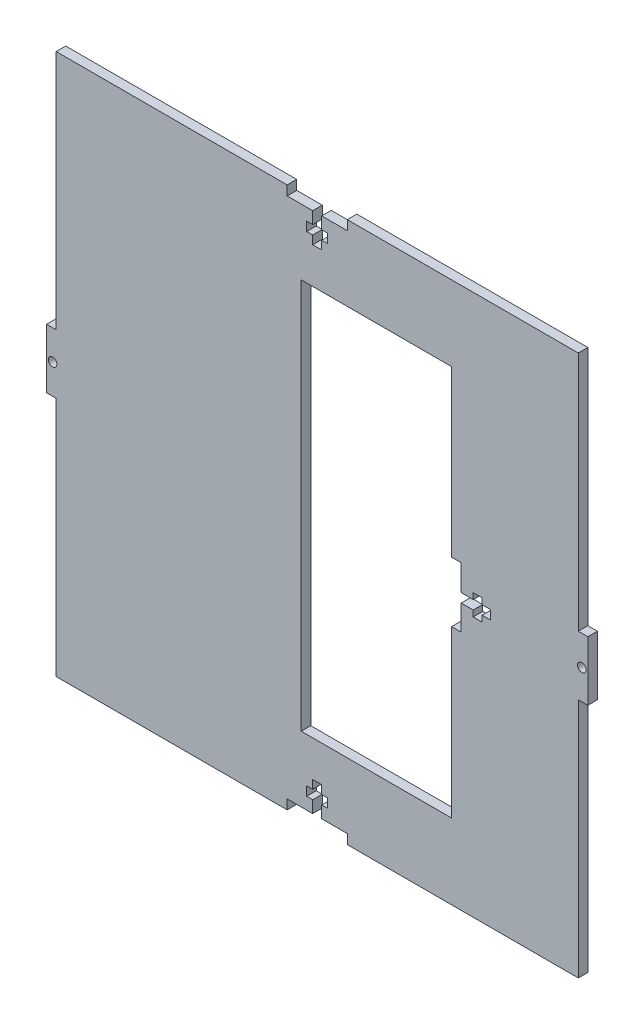
from build123d import *

# Parameters (mm, degrees)
SKETCH3_W           = 180
SKETCH3_H           = 180
BOSS_EXTRUDE1_DEPTH = 3.18
CUT_EXTRUDE1_DEPTH  = 128.318939675
SKETCH5_R           = 1.436023081
SKETCH5_W           = 3.18
SKETCH5_H           = 80.125
CUT_EXTRUDE2_DEPTH  = 128.318939675


with BuildPart() as part:
    # Sketch3 → Boss-Extrude1 (new body)
    with BuildSketch(Plane.XY):
        Rectangle(SKETCH3_W, SKETCH3_H)
        Polygon((44.679729843, -65), (-5.320270157, -65), (-5.320270157, 65), (44.679729843, 65), (44.679729843, 10.125), (47.859729843, 10.125), (47.859729843, 1.5), (51.859729843, 1.5), (51.859729843, 3.5), (54.859729843, 3.5), (54.859729843, 1.5), (57.679729843, 1.5), (57.679729843, -1.5), (54.859729843, -1.5), (54.859729843, -3.5), (51.859729843, -3.5), (51.859729843, -1.5), (47.859729843, -1.5), (47.859729843, -9.875), (44.679729843, -9.875), align=None, mode=Mode.SUBTRACT)
    extrude(amount=BOSS_EXTRUDE1_DEPTH)

    # Sketch4 → Cut-Extrude1 (cut, through all)
    with BuildSketch(Plane.XY.offset(3.18)):
        Polygon((1.5, 86.82), (10, 86.82), (10, 90), (-10, 90), (-10, 86.82), (-1.5, 86.82), (-1.5, 82.82), (-3.5, 82.82), (-3.5, 79.82), (-1.5, 79.82), (-1.5, 77), (1.5, 77), (1.5, 79.82), (3.5, 79.82), (3.5, 82.82), (1.5, 82.82), align=None)
        Polygon((1.5, -79.82), (1.5, -77), (-1.5, -77), (-1.5, -79.82), (-3.5, -79.82), (-3.5, -82.82), (-1.5, -82.82), (-1.5, -86.82), (-10, -86.82), (-10, -90), (10, -90), (10, -86.82), (1.5, -86.82), (1.5, -82.82), (3.5, -82.82), (3.5, -79.82), align=None)
    extrude(amount=-CUT_EXTRUDE1_DEPTH, mode=Mode.SUBTRACT)

    # Sketch5 → Cut-Extrude2 (cut, through all)
    with BuildSketch(Plane.XY.offset(3.18)):
        with Locations((-88, 0)):
            Circle(SKETCH5_R)
        with Locations((88, 0)):
            Circle(SKETCH5_R)
        with Locations((-88.41, 49.9375)):
            Rectangle(SKETCH5_W, SKETCH5_H)
        with Locations((-88.41, -49.9375)):
            Rectangle(SKETCH5_W, SKETCH5_H)
        with Locations((88.41, -49.9375)):
            Rectangle(SKETCH5_W, SKETCH5_H)
        with Locations((88.41, 49.9375)):
            Rectangle(SKETCH5_W, SKETCH5_H)
    extrude(amount=-CUT_EXTRUDE2_DEPTH, mode=Mode.SUBTRACT)


solid = part.part
